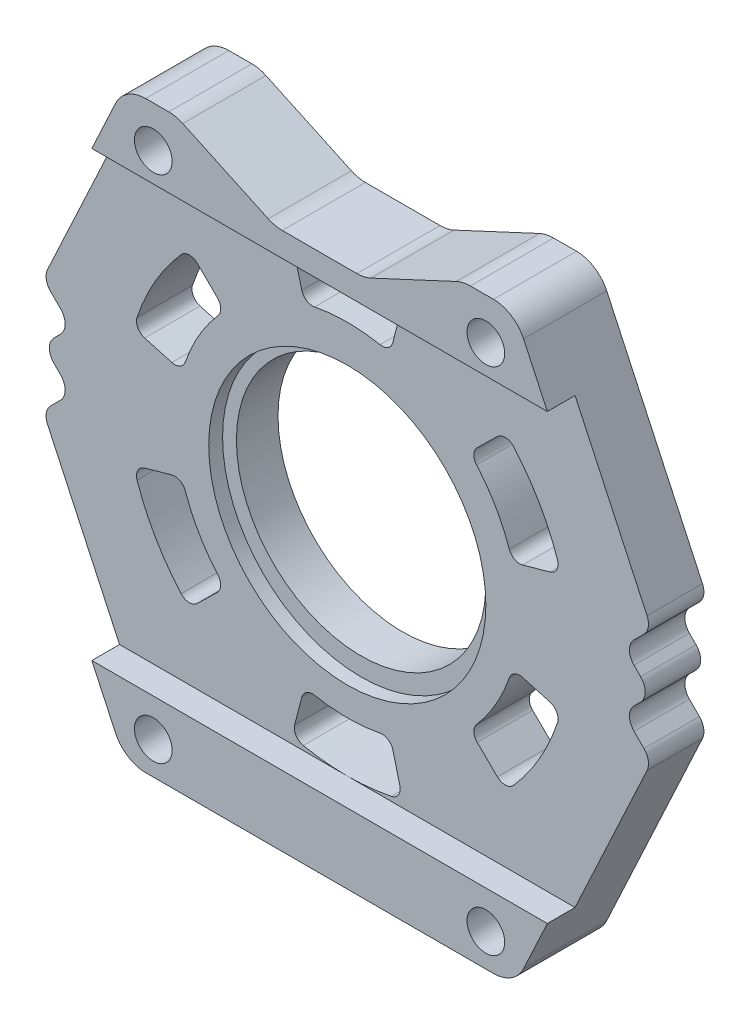
from build123d import *

# Parameters (mm, degrees)
SKETCH1_W           = 69.7357
SKETCH1_H           = 66.8909
SKETCH1_R           = 14.2875
BOSS_EXTRUDE1_DEPTH = 9.525
SKETCH2_W           = 89.996819584
SKETCH2_H           = 50.8
CUT_EXTRUDE1_DEPTH  = 3.175
SKETCH3_R           = 15.875
CUT_EXTRUDE2_DEPTH  = 1.5875
CUT_EXTRUDE3_DEPTH  = 50.245210065
FILLET1_R           = 3.81
FILLET2_R           = 1.778
CUT_EXTRUDE4_DEPTH  = 49.991669707
SKETCH6_R           = 2.159
CUT_EXTRUDE5_DEPTH  = 49.991669707


with BuildPart() as part:
    # Sketch1 → Boss-Extrude1 (new body)
    with BuildSketch(Plane.XY):
        Rectangle(SKETCH1_W, SKETCH1_H)
        with Locations(Location((0, 0, 0), (0, 0, 180))):
            Circle(SKETCH1_R, mode=Mode.SUBTRACT)
    extrude(amount=BOSS_EXTRUDE1_DEPTH)

    # Sketch2 → Cut-Extrude1 (cut)
    with BuildSketch(Plane.XY.offset(9.525)):
        Rectangle(SKETCH2_W, SKETCH2_H)
    extrude(amount=-CUT_EXTRUDE1_DEPTH, mode=Mode.SUBTRACT)

    # Sketch3 → Cut-Extrude2 (cut)
    with BuildSketch(Plane.XY.offset(6.35)):
        with Locations((0, -0.50165)):
            Circle(SKETCH3_R)
    extrude(amount=-CUT_EXTRUDE2_DEPTH, mode=Mode.SUBTRACT)

    # Sketch4 → Cut-Extrude3 (cut, through all)
    with BuildSketch(Plane(origin=(0, 0, 0), x_dir=(-1, 0, 0), z_dir=(0, 0, -1))):
        Polygon((-34.86785, 6.551654679), (-22.346309376, 33.44545), (-34.86785, 33.44545), align=None)
        Polygon((-31.592022661, 3.275827339), (-34.86785, 6.551654679), (-34.86785, 0), align=None)
        Polygon((-31.592022661, -3.275827339), (-34.86785, 0), (-34.86785, -6.551654679), align=None)
        Polygon((-22.346309376, -33.44545), (-34.86785, -6.551654679), (-34.86785, -33.44545), align=None)
        Polygon((34.86785, -33.44545), (34.86785, -6.551654679), (22.346309376, -33.44545), align=None)
        Polygon((-5.118898156, 28.176296472), (5.118898156, 28.176296472), (16.435998884, 33.44545), (-16.435998884, 33.44545), align=None)
        Polygon((34.86785, 33.44545), (22.346309376, 33.44545), (34.86785, 6.551654679), align=None)
        Polygon((34.86785, 0), (34.86785, 6.551654679), (31.592022661, 3.275827339), align=None)
        Polygon((34.86785, -6.551654679), (34.86785, 0), (31.592022661, -3.275827339), align=None)
    extrude(amount=-CUT_EXTRUDE3_DEPTH, mode=Mode.SUBTRACT)

    # Fillet1
    fillet1_edges = [part.edges().sort_by_distance(p)[0] for p in [
        (-5.118898156, 28.176296472, 4.7625),
        (5.118898156, 28.176296472, 4.7625),
        (16.435998884, 33.44545, 4.7625),
        (-16.435998884, 33.44545, 4.7625),
        (-22.346309376, 33.44545, 4.7625),
        (22.346309376, 33.44545, 4.7625),
        (22.346309376, -33.44545, 4.7625),
        (-22.346309376, -33.44545, 4.7625),
    ]]
    fillet(fillet1_edges, radius=FILLET1_R)

    # Fillet2
    fillet2_edges = [part.edges().sort_by_distance(p)[0] for p in [
        (31.592022661, -3.275827339, 3.175),
        (-34.86785, 6.551654679, 3.175),
        (-34.86785, 0, 3.175),
        (-31.592022661, 3.275827339, 3.175),
        (-31.592022661, -3.275827339, 3.175),
        (34.86785, 6.551654679, 3.175),
        (31.592022661, 3.275827339, 3.175),
        (34.86785, 0, 3.175),
        (34.86785, -6.551654679, 3.175),
        (-34.86785, -6.551654679, 3.175),
    ]]
    fillet(fillet2_edges, radius=FILLET2_R)

    # Sketch5 → Cut-Extrude4 (cut, through all)
    with BuildSketch(Plane(origin=(0, 0, 0), x_dir=(-1, 0, 0), z_dir=(0, 0, -1))):
        with BuildLine():
            Line((5.214806052, 20.196856995), (6.024138943, 23.3313898))
            ThreePointArc((6.024138943, 23.3313898), (5.871123899, 24.322469299), (5.046807084, 24.893568211))
            ThreePointArc((5.046807084, 24.893568211), (0, 25.4), (-5.046807084, 24.893568211))
            ThreePointArc((-5.046807084, 24.893568211), (-5.871123899, 24.322469299), (-6.024138943, 23.3313898))
            Line((-6.024138943, 23.3313898), (-5.214806052, 20.196856995))
            ThreePointArc((-5.214806052, 20.196856995), (-4.663096918, 19.440454734), (-3.742950076, 19.267662556))
            ThreePointArc((-3.742950076, 19.267662556), (0, 19.62785), (3.742950076, 19.267662556))
            ThreePointArc((3.742950076, 19.267662556), (4.663096918, 19.440454734), (5.214806052, 20.196856995))
        make_face()
        with BuildLine():
            Line((20.09839426, 5.58227398), (23.217645744, 6.44863754))
            ThreePointArc((23.217645744, 6.44863754), (23.999438245, 7.076692204), (24.081866003, 8.076120962))
            ThreePointArc((24.081866003, 8.076120962), (21.997045256, 12.7), (19.035058919, 16.817447248))
            ThreePointArc((19.035058919, 16.817447248), (18.128314346, 17.245777095), (17.193506801, 16.88275226))
            Line((17.193506801, 16.88275226), (14.883588208, 14.614583014))
            ThreePointArc((14.883588208, 14.614583014), (14.504379202, 13.758587758), (14.814810207, 12.875321128))
            ThreePointArc((14.814810207, 12.875321128), (16.998216722, 9.813925), (18.557760282, 6.392341427))
            ThreePointArc((18.557760282, 6.392341427), (19.16747612, 5.681866976), (20.09839426, 5.58227398))
        make_face()
        with BuildLine():
            Line((14.883588208, -14.614583014), (17.193506801, -16.88275226))
            ThreePointArc((17.193506801, -16.88275226), (18.128314346, -17.245777095), (19.035058919, -16.817447248))
            ThreePointArc((19.035058919, -16.817447248), (21.997045256, -12.7), (24.081866003, -8.076120962))
            ThreePointArc((24.081866003, -8.076120962), (23.999438245, -7.076692204), (23.217645744, -6.44863754))
            Line((23.217645744, -6.44863754), (20.09839426, -5.58227398))
            ThreePointArc((20.09839426, -5.58227398), (19.16747612, -5.681866976), (18.557760282, -6.392341427))
            ThreePointArc((18.557760282, -6.392341427), (16.998216722, -9.813925), (14.814810207, -12.875321128))
            ThreePointArc((14.814810207, -12.875321128), (14.504379202, -13.758587758), (14.883588208, -14.614583014))
        make_face()
        with BuildLine():
            Line((-5.214806052, -20.196856995), (-6.024138943, -23.3313898))
            ThreePointArc((-6.024138943, -23.3313898), (-5.871123899, -24.322469299), (-5.046807084, -24.893568211))
            ThreePointArc((-5.046807084, -24.893568211), (0, -25.4), (5.046807084, -24.893568211))
            ThreePointArc((5.046807084, -24.893568211), (5.871123899, -24.322469299), (6.024138943, -23.3313898))
            Line((6.024138943, -23.3313898), (5.214806052, -20.196856995))
            ThreePointArc((5.214806052, -20.196856995), (4.663096918, -19.440454734), (3.742950076, -19.267662556))
            ThreePointArc((3.742950076, -19.267662556), (0, -19.62785), (-3.742950076, -19.267662556))
            ThreePointArc((-3.742950076, -19.267662556), (-4.663096918, -19.440454734), (-5.214806052, -20.196856995))
        make_face()
        with BuildLine():
            Line((-20.09839426, -5.58227398), (-23.217645744, -6.44863754))
            ThreePointArc((-23.217645744, -6.44863754), (-23.999438245, -7.076692204), (-24.081866003, -8.076120962))
            ThreePointArc((-24.081866003, -8.076120962), (-21.997045256, -12.7), (-19.035058919, -16.817447248))
            ThreePointArc((-19.035058919, -16.817447248), (-18.128314346, -17.245777095), (-17.193506801, -16.88275226))
            Line((-17.193506801, -16.88275226), (-14.883588208, -14.614583014))
            ThreePointArc((-14.883588208, -14.614583014), (-14.504379202, -13.758587758), (-14.814810207, -12.875321128))
            ThreePointArc((-14.814810207, -12.875321128), (-16.998216722, -9.813925), (-18.557760282, -6.392341427))
            ThreePointArc((-18.557760282, -6.392341427), (-19.16747612, -5.681866976), (-20.09839426, -5.58227398))
        make_face()
        with BuildLine():
            Line((-14.883588208, 14.614583014), (-17.193506801, 16.88275226))
            ThreePointArc((-17.193506801, 16.88275226), (-18.128314346, 17.245777095), (-19.035058919, 16.817447248))
            ThreePointArc((-19.035058919, 16.817447248), (-21.997045256, 12.7), (-24.081866003, 8.076120962))
            ThreePointArc((-24.081866003, 8.076120962), (-23.999438245, 7.076692204), (-23.217645744, 6.44863754))
            Line((-23.217645744, 6.44863754), (-20.09839426, 5.58227398))
            ThreePointArc((-20.09839426, 5.58227398), (-19.16747612, 5.681866976), (-18.557760282, 6.392341427))
            ThreePointArc((-18.557760282, 6.392341427), (-16.998216722, 9.813925), (-14.814810207, 12.875321128))
            ThreePointArc((-14.814810207, 12.875321128), (-14.504379202, 13.758587758), (-14.883588208, 14.614583014))
        make_face()
    extrude(amount=-CUT_EXTRUDE4_DEPTH, mode=Mode.SUBTRACT)

    # Sketch6 → Cut-Extrude5 (cut, through all)
    with BuildSketch(Plane.XY.offset(9.525)):
        with Locations((-19.05, 28.70835)):
            Circle(SKETCH6_R)
        with Locations((19.05, 28.70835)):
            Circle(SKETCH6_R)
        with Locations((-19.05, -29.71165)):
            Circle(SKETCH6_R)
        with Locations((19.05, -29.71165)):
            Circle(SKETCH6_R)
    extrude(amount=-CUT_EXTRUDE5_DEPTH, mode=Mode.SUBTRACT)


solid = part.part
